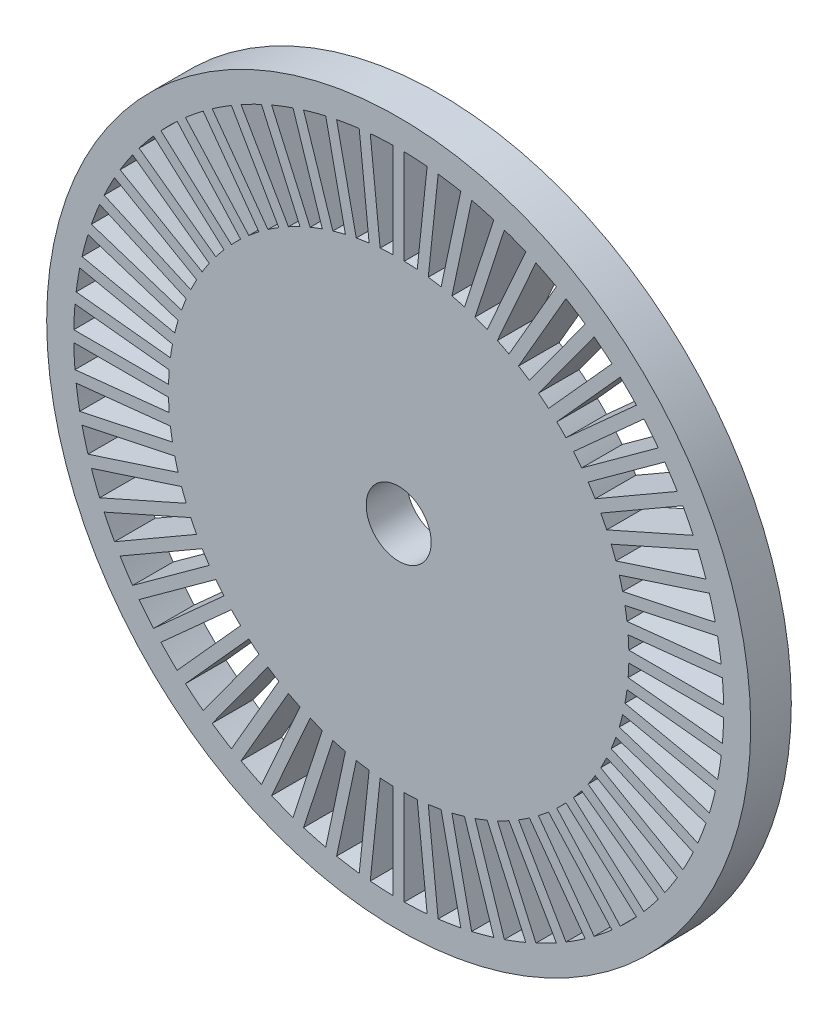
from build123d import *

# Parameters (mm, degrees)
SZKIC1_R                    = 13
SZKIC1_R_2                  = 1.2
DODANIE_WYCI_GNI_CIE1_DEPTH = 1.5
SZKIC2_R                    = 12
SZKIC2_R_2                  = 8.5
WYTNIJ_WYCI_GNI_CIE1_DEPTH  = 1.5
SZKIC3_W                    = 0.41
SZKIC3_H                    = 4.153771569
DODANIE_WYCI_GNI_CIE2_DEPTH = 1.5
SZYK_KO_OWY1_COUNT          = 60


with BuildPart() as part:
    # Szkic1 → Dodanie-wyciągnięcie1 (new body)
    with BuildSketch(Plane.XY):
        Circle(SZKIC1_R)
        Circle(SZKIC1_R_2, mode=Mode.SUBTRACT)
    extrude(amount=DODANIE_WYCI_GNI_CIE1_DEPTH)

    # Szkic2 → Wytnij-wyciągnięcie1 (cut)
    with BuildSketch(Plane(origin=(0, 0, 0), x_dir=(-1, 0, 0), z_dir=(0, 0, -1))):
        Circle(SZKIC2_R)
        Circle(SZKIC2_R_2, mode=Mode.SUBTRACT)
    extrude(amount=-WYTNIJ_WYCI_GNI_CIE1_DEPTH, mode=Mode.SUBTRACT)


with BuildPart() as wytnij_wyci_gni_cie1_piece_1:
    # of the separate pieces the step leaves, piece 1, a body of its own (wytnij_wyci_gni_cie1_pieces)
    add(part.part.solids().sort_by_distance((-8.5, 0, 0))[0])



with BuildPart() as wytnij_wyci_gni_cie1_piece_2:
    # of the separate pieces the step leaves, piece 2, a body of its own (wytnij_wyci_gni_cie1_pieces)
    add(part.part.solids().sort_by_distance((13, 0, 0))[0])


with BuildPart() as wytnij_wyci_gni_cie1_piece_1_1:
    add(wytnij_wyci_gni_cie1_piece_1.part)

    add(wytnij_wyci_gni_cie1_piece_2.part)  # Dodanie-wyciągnięcie2 merges Wytnij-wyciągnięcie1 piece 2
    # Szkic3 → Dodanie-wyciągnięcie2 (add)
    with BuildSketch(Plane.XY.offset(1.5)):
        with Locations((0, 10.220641082)):
            Rectangle(SZKIC3_W, SZKIC3_H)
    dodanie_wyci_gni_cie2 = extrude(amount=-DODANIE_WYCI_GNI_CIE2_DEPTH)

    # Szyk kołowy1: Dodanie-wyciągnięcie2 ×60 about axis
    szyk_ko_owy1_axis = Axis((0, 0, 0), (0, 0, 1))
    for i in range(1, SZYK_KO_OWY1_COUNT):
        add(dodanie_wyci_gni_cie2.rotate(szyk_ko_owy1_axis, i * 360 / SZYK_KO_OWY1_COUNT))


solid = wytnij_wyci_gni_cie1_piece_1_1.part
